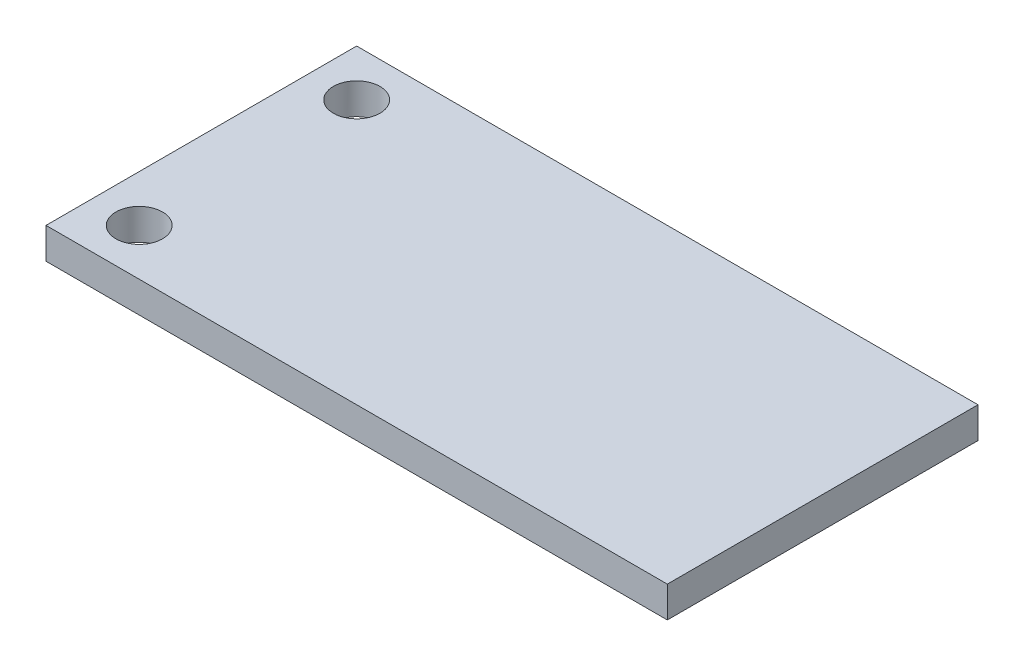
from build123d import *

# Parameters (mm, degrees)
SKETCH2_W           = 40
SKETCH2_H           = 20
BOSS_EXTRUDE1_DEPTH = 2
CUT_EXTRUDE1_REACH  = 46.766
SKETCH3_R           = 1.5


with BuildPart() as part:
    # Sketch2 → Boss-Extrude1 (new body)
    with BuildSketch(Plane(origin=(0, 0, 0), x_dir=(1, 0, 0), z_dir=(0, 1, 0))):
        with Locations((20, 10)):
            Rectangle(SKETCH2_W, SKETCH2_H)
    extrude(amount=BOSS_EXTRUDE1_DEPTH)

    # Sketch3 → Cut-Extrude1 (cut, up to next)
    with BuildSketch(Plane(origin=(0, 2, 0), x_dir=(1, 0, 0), z_dir=(0, 1, 0)), mode=Mode.PRIVATE) as cut_extrude1_sk1:
        with Locations(Location((3, 17, 0), (0, 0, 270))):
            Circle(SKETCH3_R)
    cut_extrude1_tool1 = extrude(cut_extrude1_sk1.sketch, amount=-CUT_EXTRUDE1_REACH, mode=Mode.PRIVATE) & part.part
    cut_extrude1 = cut_extrude1_tool1.solids().sort_by_distance((3, 2, -17))[0]
    add(cut_extrude1, mode=Mode.SUBTRACT)

    # Mirror1: Cut-Extrude1 across plane
    add(cut_extrude1.mirror(Plane(origin=(0, 0, -10), x_dir=(1, 0, 0), z_dir=(0, 0, -1))), mode=Mode.SUBTRACT)


solid = part.part
